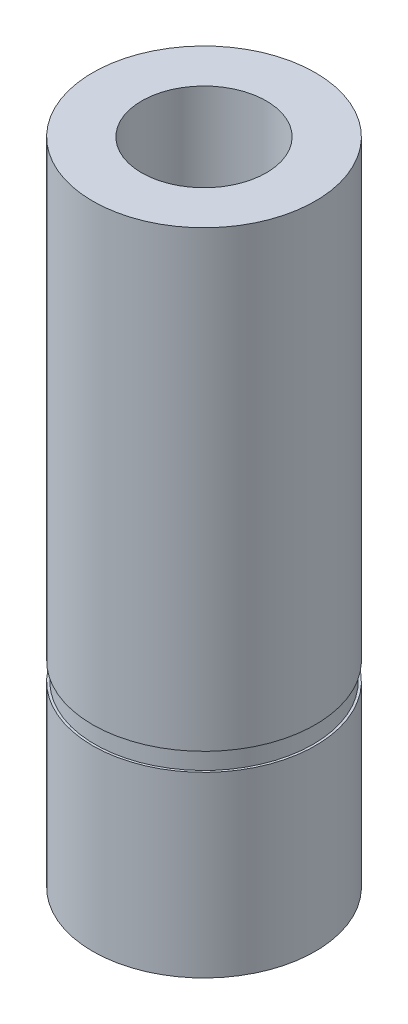
from build123d import *

# Parameters (mm, degrees)
SKETCH1_R               = 6.125
SKETCH1_R_2             = 3.43
BOSS_EXTRUDE1_DEPTH     = 17.875
CUT_EXTRUDE_THIN1_START = -9.8
SKETCH2_R               = 6.5
SKETCH2_R_2             = 6
CUT_EXTRUDE_THIN1_DEPTH = 1


with BuildPart() as part:
    # Sketch1 → Boss-Extrude1 (new, symmetric)
    with BuildSketch(Plane(origin=(0, 0, 0), x_dir=(1, 0, 0), z_dir=(0, 1, 0))):
        with Locations(Location((0, 0, 0), (0, 0, 270))):
            Circle(SKETCH1_R)
        with Locations(Location((0, 0, 0), (0, 0, 270))):
            Circle(SKETCH1_R_2, mode=Mode.SUBTRACT)
    extrude(amount=BOSS_EXTRUDE1_DEPTH, both=True)

    # Sketch2 → Cut-Extrude-Thin1 (cut)
    with BuildSketch(Plane.XZ.offset(17.875).offset(CUT_EXTRUDE_THIN1_START)):
        Circle(SKETCH2_R)
        Circle(SKETCH2_R_2, mode=Mode.SUBTRACT)
    extrude(amount=-CUT_EXTRUDE_THIN1_DEPTH, mode=Mode.SUBTRACT)


solid = part.part
